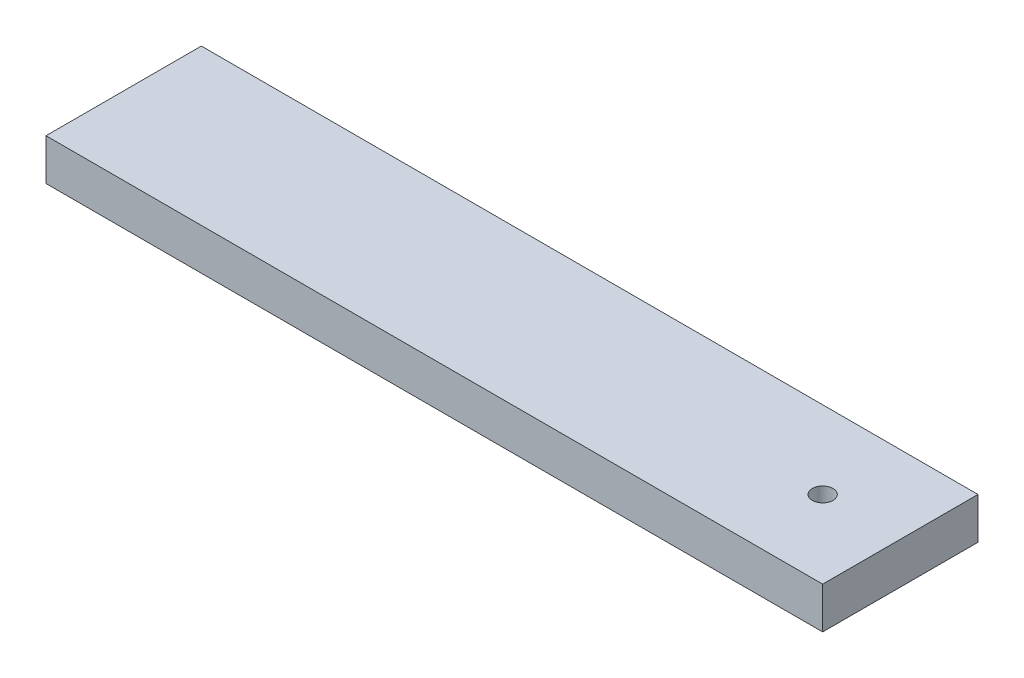
from build123d import *

# Parameters (mm, degrees)
SKETCH1_W           = 150
SKETCH1_H           = 30
SKETCH1_R           = 2
BOSS_EXTRUDE1_DEPTH = 8


with BuildPart() as part:
    # Sketch1 → Boss-Extrude1 (new body)
    with BuildSketch(Plane(origin=(0, 0, 0), x_dir=(1, 0, 0), z_dir=(0, 1, 0))):
        Rectangle(SKETCH1_W, SKETCH1_H)
        with Locations(Location((60, 0, 0), (0, 0, 270))):
            Circle(SKETCH1_R, mode=Mode.SUBTRACT)
    extrude(amount=BOSS_EXTRUDE1_DEPTH)


solid = part.part
